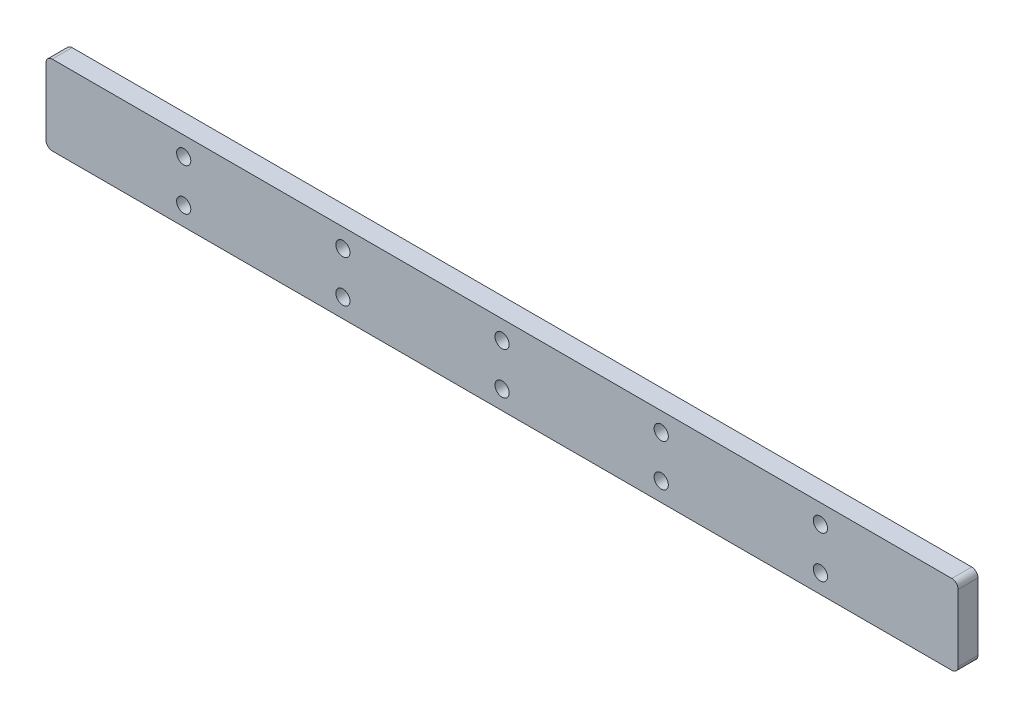
from build123d import *

# Parameters (mm, degrees)
SKETCH1_W             = 145.55
SKETCH1_H             = 12.7
BOSS_EXTRUDE1_DEPTH   = 3.175
F_4_40_TAPPED_HOLE1_D = 2.2606
LPATTERN1_COUNT       = 5
LPATTERN1_PITCH       = 25.4
FILLET1_R             = 1


with BuildPart() as part:
    # Sketch1 → Boss-Extrude1 (new body)
    with BuildSketch(Plane.XY):
        Rectangle(SKETCH1_W, SKETCH1_H)
    extrude(amount=BOSS_EXTRUDE1_DEPTH)

    # #4-40 Tapped Hole1 (through all)
    with Locations(Plane(origin=(-50.8, 3.35, 3.175), x_dir=(1, 0, 0), z_dir=(0, 0, 1))):
        with Locations((0, 0), (0, -6.7)):
            f_4_40_tapped_hole1 = Hole(F_4_40_TAPPED_HOLE1_D / 2)

    # LPattern1: #4-40 Tapped Hole1 ×5
    with Locations(*[(i * LPATTERN1_PITCH, 0, 0) for i in range(1, LPATTERN1_COUNT)]):
        add(f_4_40_tapped_hole1, mode=Mode.SUBTRACT)

    # Fillet1
    fillet1_edges = [part.edges().sort_by_distance(p)[0] for p in [
        (-72.775, 6.35, 1.5875),
        (72.775, 6.35, 1.5875),
        (72.775, -6.35, 1.5875),
        (-72.775, -6.35, 1.5875),
    ]]
    fillet(fillet1_edges, radius=FILLET1_R)


solid = part.part
